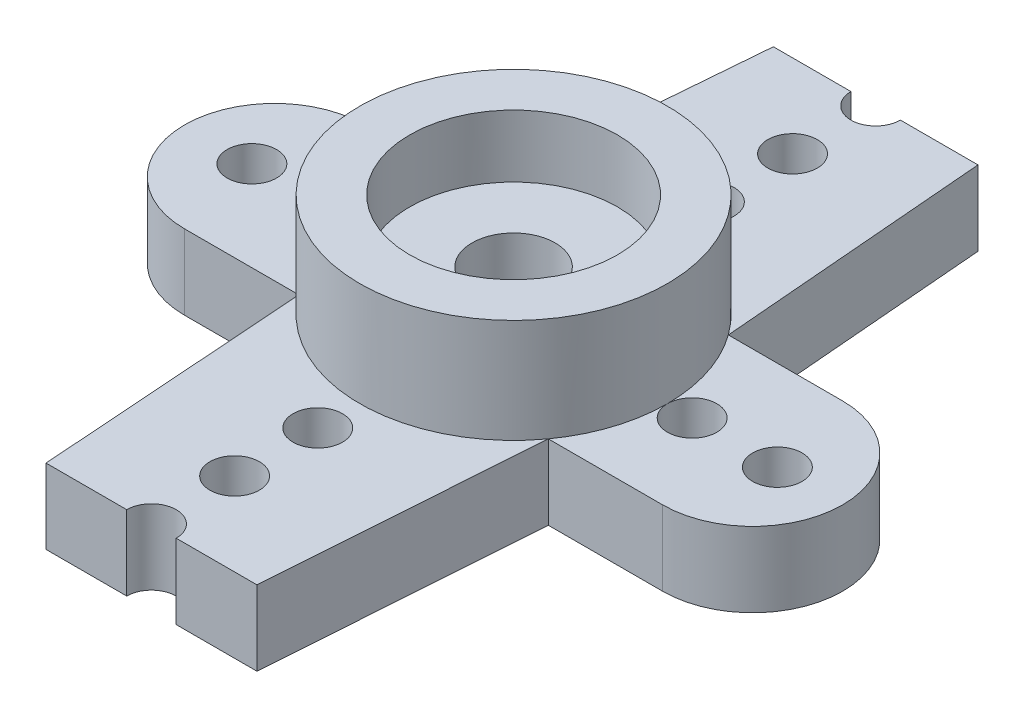
from build123d import *

# Parameters (mm, degrees)
SKETCH2_R           = 2.5
SKETCH2_R_2         = 0.595
BOSS_EXTRUDE1_DEPTH = 1.8
SKETCH3_R           = 3.7
SKETCH3_R_2         = 2.5
BOSS_EXTRUDE2_DEPTH = 2.5
SKETCH4_R           = 2.5
SKETCH4_R_2         = 1
BOSS_EXTRUDE3_DEPTH = 1.8


with BuildPart() as part:
    # Sketch2 → Boss-Extrude1 (new body)
    with BuildSketch(Plane(origin=(0, 0, 0), x_dir=(1, 0, 0), z_dir=(0, 1, 0))):
        with BuildLine():
            Line((-2.460864044, 8.71), (-0.595, 8.71))
            ThreePointArc((-0.595, 8.71), (0, 8.115), (0.595, 8.71))
            Line((0.595, 8.71), (2.460864044, 8.71))
            Line((2.460864044, 8.71), (3.000462464, 2.165))
            Line((3.000462464, 2.165), (5.750462464, 2.165))
            ThreePointArc((5.750462464, 2.165), (7.281348646, 1.530886181), (7.915462464, 0))
            ThreePointArc((7.915462464, 0), (7.281348646, -1.530886181), (5.750462464, -2.165))
            Line((5.750462464, -2.165), (3.000462464, -2.165))
            Line((3.000462464, -2.165), (2.537213308, -8.71))
            Line((2.537213308, -8.71), (0.595, -8.71))
            ThreePointArc((0.595, -8.71), (0, -8.115), (-0.595, -8.71))
            Line((-0.595, -8.71), (-2.537213308, -8.71))
            Line((-2.537213308, -8.71), (-3.000462464, -2.165))
            Line((-3.000462464, -2.165), (-5.750462464, -2.165))
            ThreePointArc((-5.750462464, -2.165), (-7.281348646, -1.530886181), (-7.915462464, 0))
            ThreePointArc((-7.915462464, 0), (-7.281348646, 1.530886181), (-5.750462464, 2.165))
            Line((-5.750462464, 2.165), (-3.000462464, 2.165))
            Line((-3.000462464, 2.165), (-2.460864044, 8.71))
        make_face()
        with Locations(Location((0, 0, 0), (0, 0, 270))):
            Circle(SKETCH2_R, mode=Mode.SUBTRACT)
        with Locations(Location((-4.295, 0, 0), (0, 0, 270))):
            Circle(SKETCH2_R_2, mode=Mode.SUBTRACT)
        with Locations(Location((-6.295, 0, 0), (0, 0, 270))):
            Circle(SKETCH2_R_2, mode=Mode.SUBTRACT)
        with Locations(Location((0, 4.71, 0), (0, 0, 270))):
            Circle(SKETCH2_R_2, mode=Mode.SUBTRACT)
        with Locations(Location((0, 6.71, 0), (0, 0, 270))):
            Circle(SKETCH2_R_2, mode=Mode.SUBTRACT)
        with Locations(Location((0, -4.71, 0), (0, 0, 90))):
            Circle(SKETCH2_R_2, mode=Mode.SUBTRACT)
        with Locations(Location((0, -6.71, 0), (0, 0, 90))):
            Circle(SKETCH2_R_2, mode=Mode.SUBTRACT)
        with Locations(Location((6.345, 0, 0), (0, 0, 90))):
            Circle(SKETCH2_R_2, mode=Mode.SUBTRACT)
        with Locations(Location((4.295, 0, 0), (0, 0, 90))):
            Circle(SKETCH2_R_2, mode=Mode.SUBTRACT)
    extrude(amount=BOSS_EXTRUDE1_DEPTH)

    # Sketch3 → Boss-Extrude2 (add)
    with BuildSketch(Plane(origin=(0, 1.8, 0), x_dir=(1, 0, 0), z_dir=(0, 1, 0))):
        with Locations(Location((0, 0, 0), (0, 0, 144.187462738))):
            Circle(SKETCH3_R)
        with Locations(Location((0, 0, 0), (0, 0, 270))):
            Circle(SKETCH3_R_2, mode=Mode.SUBTRACT)
    extrude(amount=BOSS_EXTRUDE2_DEPTH)

    # Sketch4 → Boss-Extrude3 (add)
    with BuildSketch(Plane(origin=(0, 1, 0), x_dir=(-1, 0, 0), z_dir=(0, -1, 0))):
        with Locations(Location((0, 0, 0), (0, 0, 90))):
            Circle(SKETCH4_R)
        with Locations(Location((0, 0, 0), (0, 0, 90))):
            Circle(SKETCH4_R_2, mode=Mode.SUBTRACT)
    extrude(amount=-BOSS_EXTRUDE3_DEPTH)


solid = part.part
